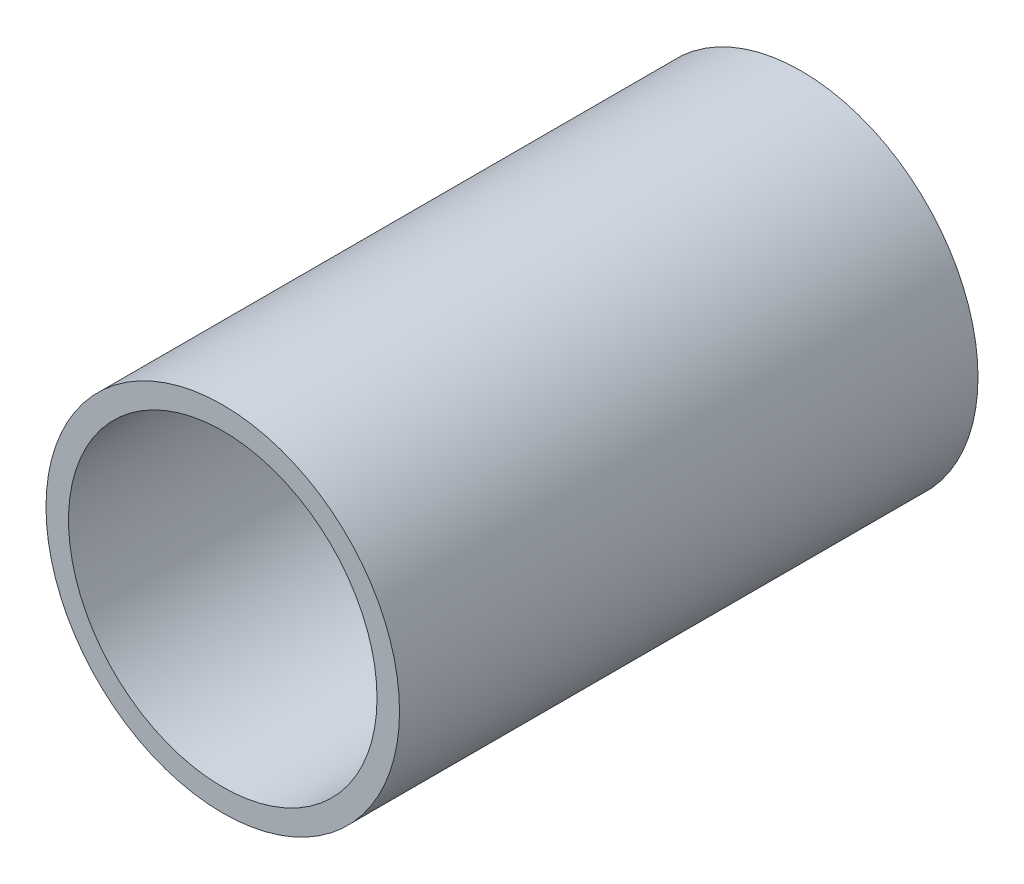
from build123d import *

# Parameters (mm, degrees)
SKETCH1_R           = 22
SKETCH1_R_2         = 19.2
BOSS_EXTRUDE1_DEPTH = 72


with BuildPart() as part:
    # Sketch1 → Boss-Extrude1 (new body)
    with BuildSketch(Plane.XY):
        Circle(SKETCH1_R)
        Circle(SKETCH1_R_2, mode=Mode.SUBTRACT)
    extrude(amount=BOSS_EXTRUDE1_DEPTH)


solid = part.part
